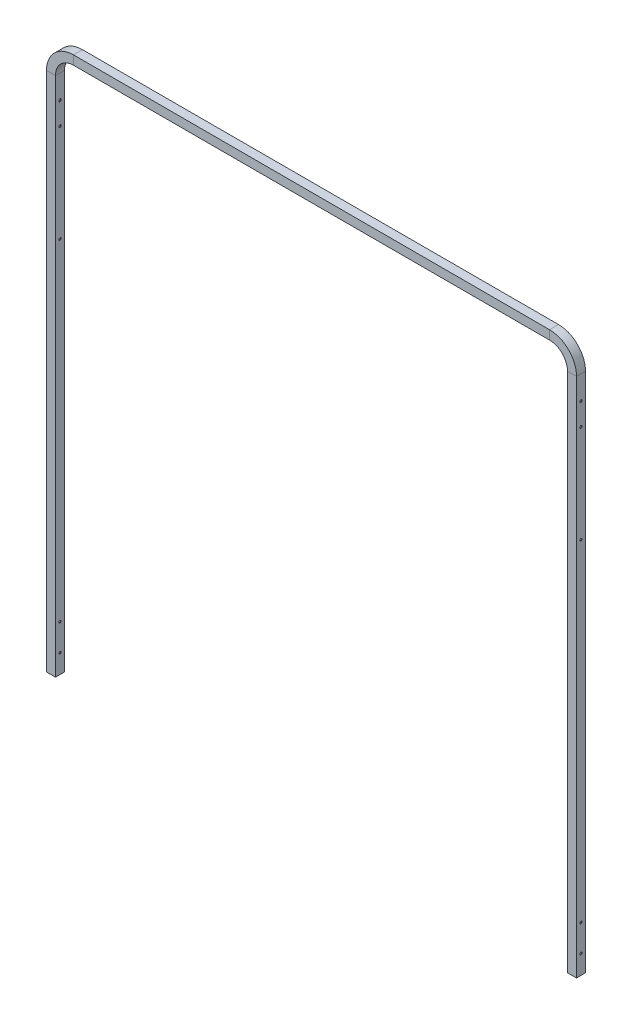
from build123d import *

# Parameters (mm, degrees)
SKETCH15_W                                    = 20
SKETCH15_H                                    = 20
SKETCH15_W_2                                  = 17.6
SKETCH15_H_2                                  = 17.6
AL_TUBE_SQUARE_AL_TUBE_0_75_SQR_X_0_065_DEPTH = 1160
SKETCH15_ON_SEGMENT_2_W                       = 20
SKETCH15_ON_SEGMENT_2_H                       = 20
SKETCH15_ON_SEGMENT_2_W_2                     = 17.6
SKETCH15_ON_SEGMENT_2_H_2                     = 17.6
AL_TUBE_SQUARE_AL_TUBE_0_75_SQR_X_0_2_ANGLE   = 90
SKETCH15_ON_SEGMENT_3_W                       = 20
SKETCH15_ON_SEGMENT_3_H                       = 20
SKETCH15_ON_SEGMENT_3_W_2                     = 17.6
SKETCH15_ON_SEGMENT_3_H_2                     = 17.6
AL_TUBE_SQUARE_AL_TUBE_0_75_SQR_X_0_3_DEPTH   = 1060
SKETCH15_ON_SEGMENT_4_W                       = 20
SKETCH15_ON_SEGMENT_4_H                       = 20
SKETCH15_ON_SEGMENT_4_W_2                     = 17.6
SKETCH15_ON_SEGMENT_4_H_2                     = 17.6
AL_TUBE_SQUARE_AL_TUBE_0_75_SQR_X_0_4_ANGLE   = 90
SKETCH15_ON_SEGMENT_5_W                       = 20
SKETCH15_ON_SEGMENT_5_H                       = 20
SKETCH15_ON_SEGMENT_5_W_2                     = 17.6
SKETCH15_ON_SEGMENT_5_H_2                     = 17.6
AL_TUBE_SQUARE_AL_TUBE_0_75_SQR_X_0_5_DEPTH   = 1160
SKETCH16_R                                    = 2.75
CUT_EXTRUDE1_DEPTH                            = 2062.480050837
SKETCH18_R                                    = 2.5
CUT_EXTRUDE2_DEPTH                            = 1698.321419178
SKETCH19_R                                    = 2.5
CUT_EXTRUDE3_DEPTH                            = 1698.321419178


with BuildPart() as part:
    # Sketch15 → Al tube square AL TUBE 0.75 SQR X 0.065 WALL(1) (new body)
    with BuildSketch(Plane(origin=(0, 0, 0), x_dir=(-1, 0, 0), z_dir=(0, 1, 0))):
        Rectangle(SKETCH15_W, SKETCH15_H)
        Rectangle(SKETCH15_W_2, SKETCH15_H_2, mode=Mode.SUBTRACT)
    extrude(amount=AL_TUBE_SQUARE_AL_TUBE_0_75_SQR_X_0_065_DEPTH)


with BuildPart() as body_2:
    # Sketch15 on segment 2 (carried to the start of arc 2) → Al tube square AL TUBE 0.75 SQR X 0. 2 (revolve)
    with BuildSketch(Plane(origin=(0, 1160, 0), x_dir=(-1, 0, 0), z_dir=(0, 1, 0))):
        Rectangle(SKETCH15_ON_SEGMENT_2_W, SKETCH15_ON_SEGMENT_2_H)
        Rectangle(SKETCH15_ON_SEGMENT_2_W_2, SKETCH15_ON_SEGMENT_2_H_2, mode=Mode.SUBTRACT)
    revolve(axis=Axis((50, 1160, 0), (0, 0, -1)), revolution_arc=AL_TUBE_SQUARE_AL_TUBE_0_75_SQR_X_0_2_ANGLE)


with BuildPart() as body_3:
    # Sketch15 on segment 3 (carried to segment 3) → Al tube square AL TUBE 0.75 SQR X 0. 3 (new body)
    with BuildSketch(Plane(origin=(50, 1210, 0), x_dir=(0, 1, 0), z_dir=(1, 0, 0))):
        Rectangle(SKETCH15_ON_SEGMENT_3_W, SKETCH15_ON_SEGMENT_3_H)
        Rectangle(SKETCH15_ON_SEGMENT_3_W_2, SKETCH15_ON_SEGMENT_3_H_2, mode=Mode.SUBTRACT)
    extrude(amount=AL_TUBE_SQUARE_AL_TUBE_0_75_SQR_X_0_3_DEPTH)


with BuildPart() as body_4:
    # Sketch15 on segment 4 (carried to the start of arc 4) → Al tube square AL TUBE 0.75 SQR X 0. 4 (revolve)
    with BuildSketch(Plane(origin=(1160, 1160, 0), x_dir=(-1, 0, 0), z_dir=(0, 1, 0))):
        Rectangle(SKETCH15_ON_SEGMENT_4_W, SKETCH15_ON_SEGMENT_4_H)
        Rectangle(SKETCH15_ON_SEGMENT_4_W_2, SKETCH15_ON_SEGMENT_4_H_2, mode=Mode.SUBTRACT)
    revolve(axis=Axis((1110, 1160, 0), (0, 0, 1)), revolution_arc=AL_TUBE_SQUARE_AL_TUBE_0_75_SQR_X_0_4_ANGLE)


with BuildPart() as body_5:
    # Sketch15 on segment 5 (carried to segment 5) → Al tube square AL TUBE 0.75 SQR X 0. 5 (new body)
    with BuildSketch(Plane(origin=(1160, 0, 0), x_dir=(-1, 0, 0), z_dir=(0, 1, 0))):
        Rectangle(SKETCH15_ON_SEGMENT_5_W, SKETCH15_ON_SEGMENT_5_H)
        Rectangle(SKETCH15_ON_SEGMENT_5_W_2, SKETCH15_ON_SEGMENT_5_H_2, mode=Mode.SUBTRACT)
    extrude(amount=AL_TUBE_SQUARE_AL_TUBE_0_75_SQR_X_0_5_DEPTH)


with BuildPart() as cut_extrude1_tool:
    # Sketch16 → Cut-Extrude1 (new, through all)
    with BuildSketch(Plane(origin=(1170, 0, -1160), x_dir=(0, 0, -1), z_dir=(1, 0, 0))):
        with Locations(Location((-1160, 1107.5, 0), (0, 0, 180))):
            Circle(SKETCH16_R)
        with Locations(Location((-1160, 1057.5, 0), (0, 0, 180))):
            Circle(SKETCH16_R)
    extrude(amount=-CUT_EXTRUDE1_DEPTH)


with BuildPart() as part_1:
    add(part.part)

    # Cut-Extrude1: cut by cut_extrude1_tool
    add(cut_extrude1_tool.part, mode=Mode.SUBTRACT)


with BuildPart() as body_5_1:
    add(body_5.part)

    # Cut-Extrude1: cut by cut_extrude1_tool
    add(cut_extrude1_tool.part, mode=Mode.SUBTRACT)


with BuildPart() as cut_extrude2_tool:
    # Sketch18 → Cut-Extrude2 (new, through all)
    with BuildSketch(Plane(origin=(1170, 0, 0), x_dir=(0, 0, -1), z_dir=(1, 0, 0))):
        with Locations(Location((0, 102, 0), (0, 0, 180))):
            Circle(SKETCH18_R)
        with Locations(Location((0, 42, 0), (0, 0, 180))):
            Circle(SKETCH18_R)
    extrude(amount=-CUT_EXTRUDE2_DEPTH)


with BuildPart() as part_2:
    add(part_1.part)

    # Cut-Extrude2: cut by cut_extrude2_tool
    add(cut_extrude2_tool.part, mode=Mode.SUBTRACT)


with BuildPart() as body_5_2:
    add(body_5_1.part)

    # Cut-Extrude2: cut by cut_extrude2_tool
    add(cut_extrude2_tool.part, mode=Mode.SUBTRACT)


with BuildPart() as cut_extrude3_tool:
    # Sketch19 → Cut-Extrude3 (new, through all)
    with BuildSketch(Plane.ZY.offset(10)):
        with Locations((0, 840.124491181)):
            Circle(SKETCH19_R)
    extrude(amount=-CUT_EXTRUDE3_DEPTH)


with BuildPart() as part_3:
    add(part_2.part)

    # Cut-Extrude3: cut by cut_extrude3_tool
    add(cut_extrude3_tool.part, mode=Mode.SUBTRACT)


with BuildPart() as body_5_3:
    add(body_5_2.part)

    # Cut-Extrude3: cut by cut_extrude3_tool
    add(cut_extrude3_tool.part, mode=Mode.SUBTRACT)


solid = Compound([body_2.part, body_3.part, body_4.part, part_3.part, body_5_3.part])
